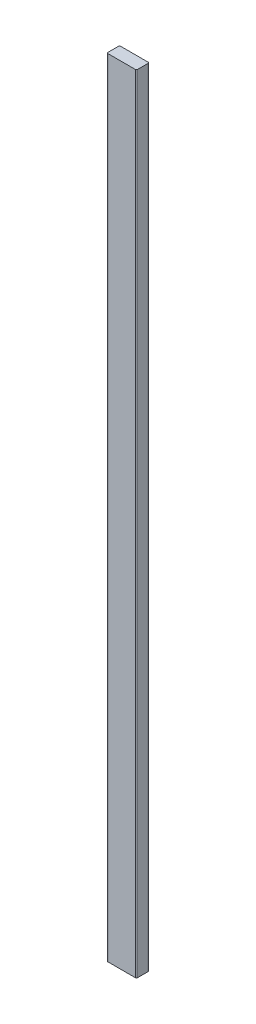
from build123d import *

# Parameters (mm, degrees)
SKETCH1_W           = 88.9
SKETCH1_H           = 38.1
BOSS_EXTRUDE1_DEPTH = 2362.2
FILLET1_R           = 3.175


with BuildPart() as part:
    # Sketch1 → Boss-Extrude1 (new body)
    with BuildSketch(Plane(origin=(0, 0, 0), x_dir=(1, 0, 0), z_dir=(0, 1, 0))):
        Rectangle(SKETCH1_W, SKETCH1_H)
    extrude(amount=BOSS_EXTRUDE1_DEPTH)

    # Fillet1
    fillet1_edges = [part.edges().sort_by_distance(p)[0] for p in [
        (-44.45, 1181.1, -19.05),
        (44.45, 1181.1, -19.05),
        (44.45, 1181.1, 19.05),
        (-44.45, 1181.1, 19.05),
    ]]
    fillet(fillet1_edges, radius=FILLET1_R)


solid = part.part
